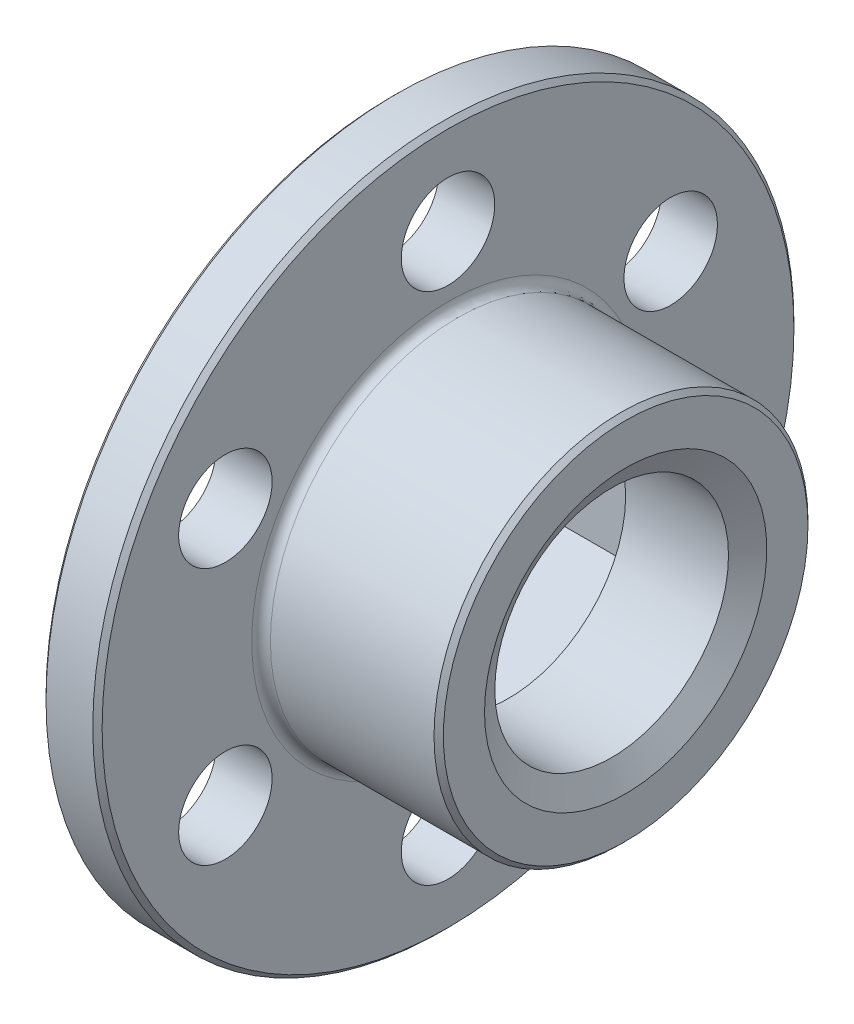
from build123d import *

# Parameters (mm, degrees)
FILLET_2_R               = 2
CHAMFER_2_SIZE           = 1
SKETCH_1_8_W             = 12
SKETCH_1_8_H             = 10
PATTERN_CIRCULAR_1_COUNT = 6
CUT_EXTRUDE_1_DEPTH      = 109.972473589


with BuildPart() as part:
    # Эскиз1 → Повернуть1 (revolve)
    with BuildSketch(Plane.XY):
        Polygon((0, 25), (50, 25), (50, 40), (12, 40), (12, 75), (0, 75), align=None)
    revolve(axis=Axis((0, 0, 0), (1, 0, 0)))

    # Скругление2
    fillet_2_edges = [part.edges().sort_by_distance(p)[0] for p in [
        (12, -40, 0),
    ]]
    fillet(fillet_2_edges, radius=FILLET_2_R)

    # Фаска2
    chamfer_2_edges = [part.edges().sort_by_distance(p)[0] for p in [
        (50, -40, 0),
        (0, -75, 0),
        (12, -75, 0),
    ]]
    chamfer(chamfer_2_edges, length=CHAMFER_2_SIZE)

    # Эскиз1<8> → Вырез-Повернуть1 (revolve, cut)
    with BuildSketch(Plane.XY):
        with Locations((6, 60)):
            Rectangle(SKETCH_1_8_W, SKETCH_1_8_H)
    cut_revolve_1 = revolve(axis=Axis((-8.265772118, 55, 0), (1, 0, 0)), mode=Mode.SUBTRACT)

    # Круговой массив1: Вырез-Повернуть1 ×6 about axis
    pattern_circular_1_axis = Axis((50, 0, 0), (-1, 0, 0))
    for i in range(1, PATTERN_CIRCULAR_1_COUNT):
        add(cut_revolve_1.rotate(pattern_circular_1_axis, i * 360 / PATTERN_CIRCULAR_1_COUNT), mode=Mode.SUBTRACT)

    # Эскиз2 → Вырез-Повернуть3 (revolve, cut)
    with BuildSketch(Plane(origin=(0, 0, 0), x_dir=(1, 0, 0), z_dir=(0, 1, 0))):
        Polygon((47, 25), (50, 25), (50, 30.196152423), align=None)
    revolve(axis=Axis((0, 0, 0), (1, 0, 0)), mode=Mode.SUBTRACT)

    # Эскиз3 → Вырез-Вытянуть1 (cut, through all)
    with BuildSketch(Plane(origin=(25, 0, 0), x_dir=(0, 0, -1), z_dir=(1, 0, 0))):
        Polygon((0, 35), (-30.310889132, 17.5), (-30.310889132, -17.5), (0, -35), (30.310889132, -17.5), (30.310889132, 17.5), align=None)
    extrude(amount=-CUT_EXTRUDE_1_DEPTH, mode=Mode.SUBTRACT)


solid = part.part
